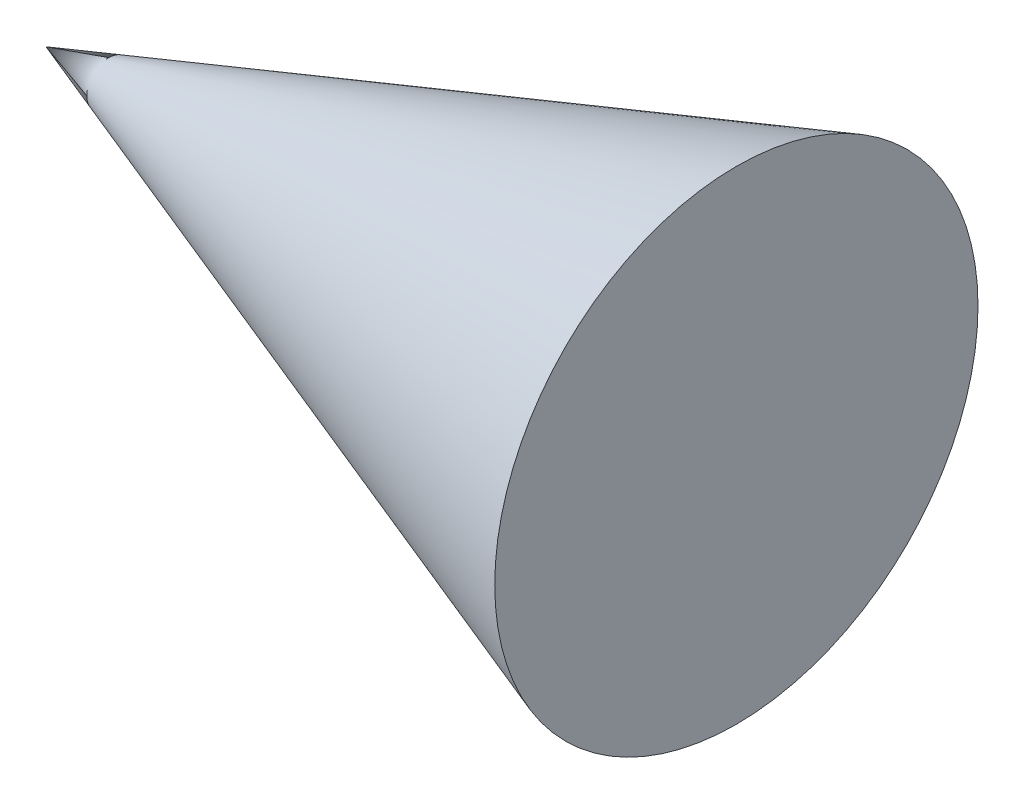
from build123d import *


with BuildPart() as part:
    # Sketch1 → Revolve1 (revolve)
    with BuildSketch(Plane.XY, mode=Mode.PRIVATE) as revolve1_sk:
        Polygon((0, 0), (20, 7), (20, 0), align=None)
    revolve(revolve1_sk.sketch.rotate(Axis((0, 0, 0), (1, 0, 0)), 270), axis=Axis((0, 0, 0), (1, 0, 0)))


solid = part.part
